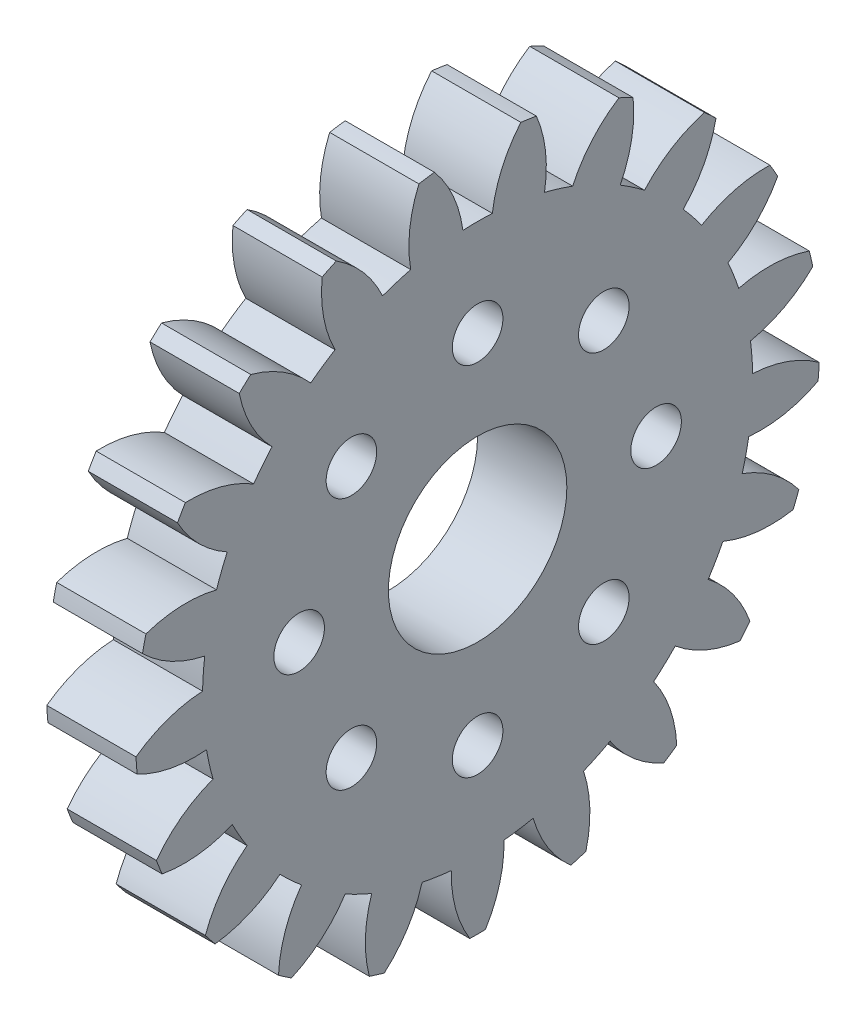
from build123d import *

# Parameters (mm, degrees)
BASPROSKE_W         = 3
BASPROSKE_H         = 11.5
TOOTHCUT_DEPTH      = 17.537835409
TEETHCUTS_COUNT     = 21
TEETHCUTS_ANGLE     = 342.857142857
BORSKE_R            = 4
BORE_DEPTH          = 50.0000508
EXTRUDE_START       = -3
SKETCH_1_R          = 4
EXTRUDE_1_DEPTH     = 3
SKETCH_2_R          = 3
SKETCH_2_R_2        = 0.85
CUT_EXTRUDE_1_DEPTH = 17.52708436


with BuildPart() as part:
    # BasProSke → Base-Revolve (revolve)
    with BuildSketch(Plane(origin=(0, 0, 0), x_dir=(1, 0, 0), z_dir=(0, 1, 0)), mode=Mode.PRIVATE) as base_revolve_sk:
        with Locations((1.5, 5.75)):
            Rectangle(BASPROSKE_W, BASPROSKE_H)
    revolve(base_revolve_sk.sketch.rotate(Axis((-10, 0, 0), (1, 0, 0)), 180), axis=Axis((-10, 0, 0), (1, 0, 0)))

    # TooCutSke → ToothCut (cut, through all)
    with BuildSketch(Plane(origin=(0, 0, 0), x_dir=(0, 0, -1), z_dir=(1, 0, 0))):
        with BuildLine():
            ThreePointArc((0.49526894, 9.235730057), (0, 9.249), (-0.49526894, 9.235730057))
            ThreePointArc((-0.49526894, 9.235730057), (-0.823521057, 10.404716786), (-1.472455249, 11.430954496))
            ThreePointArc((-1.472455249, 11.430954496), (0, 11.5254), (1.472455249, 11.430954496))
            ThreePointArc((1.472455249, 11.430954496), (0.823521057, 10.404716786), (0.49526894, 9.235730057))
        make_face()
    toothcut = extrude(amount=TOOTHCUT_DEPTH, mode=Mode.SUBTRACT)

    # TeethCuts: ToothCut ×21 about axis
    teethcuts_axis = Axis((-10, 0, 0), (1, 0, 0))
    for i in range(1, TEETHCUTS_COUNT):
        add(toothcut.rotate(teethcuts_axis, i * TEETHCUTS_ANGLE / (TEETHCUTS_COUNT - 1)), mode=Mode.SUBTRACT)

    # BorSke → Bore (cut, symmetric)
    with BuildSketch(Plane(origin=(0, 0, 0), x_dir=(0, 0, -1), z_dir=(1, 0, 0))):
        with Locations(Location((0, 0, 0), (0, 0, 180))):
            Circle(BORSKE_R)
    extrude(amount=BORE_DEPTH, both=True, mode=Mode.SUBTRACT)

    # ｽｹｯﾁ1 → ﾎﾞｽ - 押し出し1 (add)
    with BuildSketch(Plane.ZY.offset(EXTRUDE_START)):
        Circle(SKETCH_1_R)
    extrude(amount=EXTRUDE_1_DEPTH)

    # ｽｹｯﾁ2 → ｶｯﾄ - 押し出し1 (cut, through all)
    with BuildSketch(Plane(origin=(3, 0, 0), x_dir=(0, 0, -1), z_dir=(1, 0, 0))):
        Circle(SKETCH_2_R)
        with Locations((0, 6)):
            Circle(SKETCH_2_R_2)
        with Locations((4.242640687, 4.242640687)):
            Circle(SKETCH_2_R_2)
        with Locations((6, 0)):
            Circle(SKETCH_2_R_2)
        with Locations((4.242640687, -4.242640687)):
            Circle(SKETCH_2_R_2)
        with Locations((0, -6)):
            Circle(SKETCH_2_R_2)
        with Locations((-4.242640687, -4.242640687)):
            Circle(SKETCH_2_R_2)
        with Locations((-6, 0)):
            Circle(SKETCH_2_R_2)
        with Locations((-4.242640687, 4.242640687)):
            Circle(SKETCH_2_R_2)
    extrude(amount=-CUT_EXTRUDE_1_DEPTH, mode=Mode.SUBTRACT)


solid = part.part
